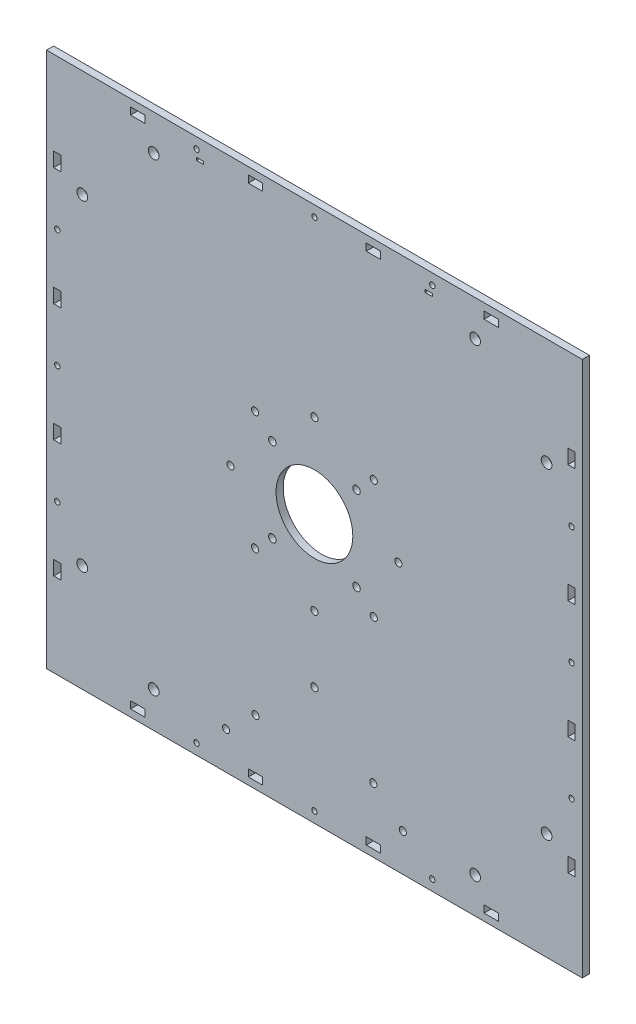
from build123d import *

# Parameters (mm, degrees)
SKETCH_1_R          = 21.5
SKETCH_1_R_2        = 2.1
SKETCH_1_W          = 4
SKETCH_1_H          = 1.5
EXTRUDE_1_DEPTH     = 4
SKETCH_3_R          = 1.5
SKETCH_3_R_2        = 2
SKETCH_3_W          = 8.03
SKETCH_3_H          = 4.03
SKETCH_3_W_2        = 4.03
SKETCH_3_H_2        = 8.03
CUT_EXTRUDE_2_DEPTH = 4
SKETCH_7_R          = 3
CUT_EXTRUDE_3_DEPTH = 10


with BuildPart() as part:
    # 草图1 → 凸台-拉伸1 (new body)
    with BuildSketch(Plane.XY):
        Polygon((151.457142857, -41.187142857), (151.457142857, 108.812857143), (-148.542857143, 108.812857143), (-148.542857143, -191.187142857), (151.457142857, -191.187142857), align=None)
        with Locations((1.457142857, -41.187142857)):
            Circle(SKETCH_1_R, mode=Mode.SUBTRACT)
        with Locations((25.027142857, -17.617142857)):
            Circle(SKETCH_1_R_2, mode=Mode.SUBTRACT)
        with Locations((25.027142857, -64.757142857)):
            Circle(SKETCH_1_R_2, mode=Mode.SUBTRACT)
        with Locations((-22.112857143, -64.757142857)):
            Circle(SKETCH_1_R_2, mode=Mode.SUBTRACT)
        with Locations((-22.112857143, -17.617142857)):
            Circle(SKETCH_1_R_2, mode=Mode.SUBTRACT)
        with Locations((65.457142857, 98.062857143)):
            Rectangle(SKETCH_1_W, SKETCH_1_H, mode=Mode.SUBTRACT)
        with Locations((-62.542857143, 98.062857143)):
            Rectangle(SKETCH_1_W, SKETCH_1_H, mode=Mode.SUBTRACT)
    extrude(amount=EXTRUDE_1_DEPTH)

    # 草图3 → 切除-拉伸2 (cut)
    with BuildSketch(Plane.XY.offset(4)):
        with Locations((1.457142857, -185.187142857)):
            Circle(SKETCH_3_R)
        with Locations((67.457142857, -185.187142857)):
            Circle(SKETCH_3_R)
        with Locations(Location((-64.542857143, -185.187142857, 0), (0, 0, 180))):
            Circle(SKETCH_3_R)
        with Locations(Location((-142.542857143, 24.812857143, 0), (0, 0, 180))):
            Circle(SKETCH_3_R)
        with Locations((-142.542857143, -41.187142857)):
            Circle(SKETCH_3_R)
        with Locations((-142.542857143, -107.187142857)):
            Circle(SKETCH_3_R)
        with Locations(Location((67.457142857, 102.812857143, 0), (0, 0, 180))):
            Circle(SKETCH_3_R)
        with Locations((1.457142857, 102.812857143)):
            Circle(SKETCH_3_R)
        with Locations((-64.542857143, 102.812857143)):
            Circle(SKETCH_3_R)
        with Locations(Location((145.457142857, -107.187142857, 0), (0, 0, 180))):
            Circle(SKETCH_3_R)
        with Locations((145.457142857, -41.187142857)):
            Circle(SKETCH_3_R)
        with Locations((145.457142857, 24.812857143)):
            Circle(SKETCH_3_R)
        with Locations((50.957142857, -170.187142857)):
            Circle(SKETCH_3_R_2)
        with Locations(Location((-48.042857143, -170.187142857, 0), (0, 0, 180))):
            Circle(SKETCH_3_R_2)
        with Locations((-31.542857143, -155.187142857)):
            Circle(SKETCH_3_R_2)
        with Locations(Location((34.457142857, -155.187142857, 0), (0, 0, 180))):
            Circle(SKETCH_3_R_2)
        with Locations((1.457142857, -88.187142857)):
            Circle(SKETCH_3_R_2)
        with Locations((-31.776875859, -74.421161573)):
            Circle(SKETCH_3_R_2)
        with Locations((-45.542857143, -41.187142857)):
            Circle(SKETCH_3_R_2)
        with Locations((-31.776875859, -7.953124141)):
            Circle(SKETCH_3_R_2)
        with Locations((1.457142857, 5.812857143)):
            Circle(SKETCH_3_R_2)
        with Locations((34.691161573, -7.953124141)):
            Circle(SKETCH_3_R_2)
        with Locations((48.457142857, -41.187142857)):
            Circle(SKETCH_3_R_2)
        with Locations((34.691161573, -74.421161573)):
            Circle(SKETCH_3_R_2)
        with Locations((1.457142857, -125.187142857)):
            Circle(SKETCH_3_R_2)
        with Locations((100.457142857, -185.187142857)):
            Rectangle(SKETCH_3_W, SKETCH_3_H)
        with Locations((34.457142857, -185.187142857)):
            Rectangle(SKETCH_3_W, SKETCH_3_H)
        with Locations((-31.542857143, -185.187142857)):
            Rectangle(SKETCH_3_W, SKETCH_3_H)
        with Locations((-97.542857143, -185.187142857)):
            Rectangle(SKETCH_3_W, SKETCH_3_H)
        with Locations((-142.542857143, 57.812857143)):
            Rectangle(SKETCH_3_W_2, SKETCH_3_H_2)
        with Locations((-142.542857143, -8.187142857)):
            Rectangle(SKETCH_3_W_2, SKETCH_3_H_2)
        with Locations((-142.542857143, -74.187142857)):
            Rectangle(SKETCH_3_W_2, SKETCH_3_H_2)
        with Locations((-142.542857143, -140.187142857)):
            Rectangle(SKETCH_3_W_2, SKETCH_3_H_2)
        with Locations((100.457142857, 102.812857143)):
            Rectangle(SKETCH_3_W, SKETCH_3_H)
        with Locations((34.457142857, 102.812857143)):
            Rectangle(SKETCH_3_W, SKETCH_3_H)
        with Locations((-31.542857143, 102.812857143)):
            Rectangle(SKETCH_3_W, SKETCH_3_H)
        with Locations((-97.542857143, 102.812857143)):
            Rectangle(SKETCH_3_W, SKETCH_3_H)
        with Locations((145.457142857, -140.187142857)):
            Rectangle(SKETCH_3_W_2, SKETCH_3_H_2)
        with Locations((145.457142857, -74.187142857)):
            Rectangle(SKETCH_3_W_2, SKETCH_3_H_2)
        with Locations((145.457142857, -8.187142857)):
            Rectangle(SKETCH_3_W_2, SKETCH_3_H_2)
        with Locations((145.457142857, 57.812857143)):
            Rectangle(SKETCH_3_W_2, SKETCH_3_H_2)
    extrude(amount=-CUT_EXTRUDE_2_DEPTH, mode=Mode.SUBTRACT)

    # 草图7 → 切除-拉伸3 (cut)
    with BuildSketch(Plane.XY.offset(4)):
        with Locations((-88.542857143, -171.187142857)):
            Circle(SKETCH_7_R)
        with Locations((91.457142857, -171.187142857)):
            Circle(SKETCH_7_R)
        with Locations((-128.542857143, 48.812857143)):
            Circle(SKETCH_7_R)
        with Locations((-128.542857143, -131.187142857)):
            Circle(SKETCH_7_R)
        with Locations((91.457142857, 88.812857143)):
            Circle(SKETCH_7_R)
        with Locations((-88.542857143, 88.812857143)):
            Circle(SKETCH_7_R)
        with Locations((131.457142857, -131.187142857)):
            Circle(SKETCH_7_R)
        with Locations((131.457142857, 48.812857143)):
            Circle(SKETCH_7_R)
    extrude(amount=-CUT_EXTRUDE_3_DEPTH, mode=Mode.SUBTRACT)


solid = part.part
